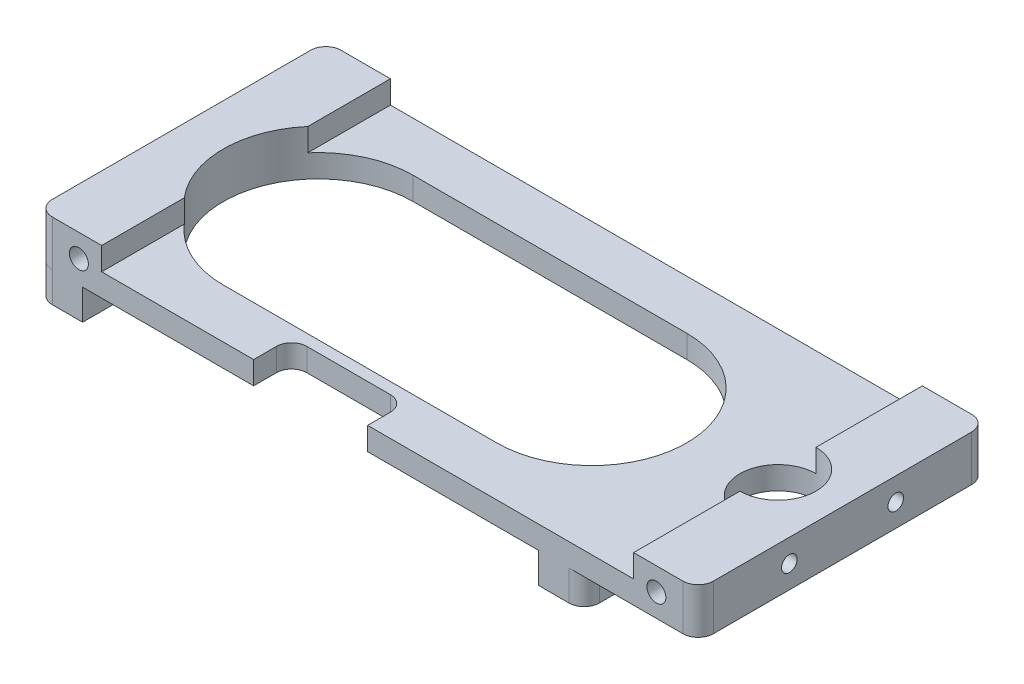
from build123d import *

# Parameters (mm, degrees)
BOSS_EXTRUDE1_DEPTH          = 38
FILLET3_R                    = 2
CUT_EXTRUDE1_DEPTH           = 98.349792201
CUT_EXTRUDE1_DEPTH_BACK      = 98.349792201
SKETCH3_W                    = 15
SKETCH3_H                    = 5
M3X0_5_TAPPED_HOLE3_D        = 2.5
M3X0_5_TAPPED_HOLE3_DEPTH    = 7.5
M3X0_5_TAPPED_HOLE3_TIP      = 0.751075774
M3X0_5_TAPPED_HOLE4_D        = 2.5
M3X0_5_TAPPED_HOLE4_DEPTH    = 7.5
M3X0_5_TAPPED_HOLE4_TIP      = 0.751075774
M2_5X0_45_TAPPED_HOLE1_D     = 2.05
M2_5X0_45_TAPPED_HOLE1_DEPTH = 6.35
M2_5X0_45_TAPPED_HOLE1_TIP   = 0.615882135
M2_5X0_45_TAPPED_HOLE2_D     = 2.05
M2_5X0_45_TAPPED_HOLE2_DEPTH = 6.35
M2_5X0_45_TAPPED_HOLE2_TIP   = 0.615882135
SKETCH14_R                   = 5
CUT_EXTRUDE2_DEPTH           = 98.488368751
SKETCH16_W                   = 6
SKETCH16_H                   = 6
BOSS_EXTRUDE2_DEPTH          = 4
FILLET4_R                    = 2
M3X0_5_TAPPED_HOLE5_D        = 2.5
M3X0_5_TAPPED_HOLE5_DEPTH    = 5.5
M3X0_5_TAPPED_HOLE5_TIP      = 0.751075774


with BuildPart() as part:
    # Sketch2 → Boss-Extrude1 (new body)
    with BuildSketch(Plane.XY.offset(11)):
        Polygon((-84.06534388, 85.95185693), (-75.56534388, 85.95185693), (-75.56534388, 82.95185693), (-5.56534388, 82.95185693), (-5.56534388, 85.95185693), (2.93465612, 85.95185693), (2.93465612, 79.95185693), (-84.06534388, 79.95185693), align=None)
    extrude(amount=BOSS_EXTRUDE1_DEPTH)

    # Fillet3
    fillet3_edges = [part.edges().sort_by_distance(p)[0] for p in [
        (2.93465612, 82.95185693, 49),
        (-84.06534388, 82.95185693, 11),
        (-84.06534388, 82.95185693, 49),
        (2.93465612, 82.95185693, 11),
    ]]
    fillet(fillet3_edges, radius=FILLET3_R)

    # Sketch3 → Cut-Extrude1 (cut, two sides: drawn at the far end of the back side and taken through both)
    with BuildSketch(Plane(origin=(0, 82.95185693, 0), x_dir=(1, 0, 0), z_dir=(0, 1, 0)).offset(-CUT_EXTRUDE1_DEPTH_BACK)):
        with BuildLine():
            Line((-66.06534388, -42.5), (-30.06534388, -42.5))
            ThreePointArc((-30.06534388, -42.5), (-17.56534388, -30), (-30.06534388, -17.5))
            Line((-30.06534388, -17.5), (-66.06534388, -17.5))
            ThreePointArc((-66.06534388, -17.5), (-78.56534388, -30), (-66.06534388, -42.5))
        make_face()
        with Locations((-48.06534388, -46.5)):
            Rectangle(SKETCH3_W, SKETCH3_H)
    extrude(amount=CUT_EXTRUDE1_DEPTH + CUT_EXTRUDE1_DEPTH_BACK, mode=Mode.SUBTRACT)

    # M3x0.5 Tapped Hole3
    with Locations(Plane.XY.offset(49)):
        with Locations((-78.56534388, 82.95185693), (-2.56534388, 82.95185693)):
            Hole(M3X0_5_TAPPED_HOLE3_D / 2, depth=M3X0_5_TAPPED_HOLE3_DEPTH)
            with Locations((0, 0, -(M3X0_5_TAPPED_HOLE3_DEPTH + M3X0_5_TAPPED_HOLE3_TIP / 2))):  # 118° drill point
                Cone(0, M3X0_5_TAPPED_HOLE3_D / 2, M3X0_5_TAPPED_HOLE3_TIP, mode=Mode.SUBTRACT)

    # M3x0.5 Tapped Hole4
    with Locations(Plane(origin=(0, 0, 11), x_dir=(-1, 0, 0), z_dir=(0, 0, -1))):
        with Locations((2.56534388, 82.95185693), (78.56534388, 82.95185693)):
            Hole(M3X0_5_TAPPED_HOLE4_D / 2, depth=M3X0_5_TAPPED_HOLE4_DEPTH)
            with Locations((0, 0, -(M3X0_5_TAPPED_HOLE4_DEPTH + M3X0_5_TAPPED_HOLE4_TIP / 2))):  # 118° drill point
                Cone(0, M3X0_5_TAPPED_HOLE4_D / 2, M3X0_5_TAPPED_HOLE4_TIP, mode=Mode.SUBTRACT)

    # M2.5x0.45 Tapped Hole1
    with Locations(Plane.ZY.offset(84.06534388)):
        with Locations((23, 82.95185693), (37, 82.95185693)):
            Hole(M2_5X0_45_TAPPED_HOLE1_D / 2, depth=M2_5X0_45_TAPPED_HOLE1_DEPTH)
            with Locations((0, 0, -(M2_5X0_45_TAPPED_HOLE1_DEPTH + M2_5X0_45_TAPPED_HOLE1_TIP / 2))):  # 118° drill point
                Cone(0, M2_5X0_45_TAPPED_HOLE1_D / 2, M2_5X0_45_TAPPED_HOLE1_TIP, mode=Mode.SUBTRACT)

    # M2.5x0.45 Tapped Hole2
    with Locations(Plane(origin=(2.93465612, 0, 0), x_dir=(0, 0, -1), z_dir=(1, 0, 0))):
        with Locations((-37, 82.95185693), (-23, 82.95185693)):
            Hole(M2_5X0_45_TAPPED_HOLE2_D / 2, depth=M2_5X0_45_TAPPED_HOLE2_DEPTH)
            with Locations((0, 0, -(M2_5X0_45_TAPPED_HOLE2_DEPTH + M2_5X0_45_TAPPED_HOLE2_TIP / 2))):  # 118° drill point
                Cone(0, M2_5X0_45_TAPPED_HOLE2_D / 2, M2_5X0_45_TAPPED_HOLE2_TIP, mode=Mode.SUBTRACT)

    # Sketch14 → Cut-Extrude2 (cut, through all)
    with BuildSketch(Plane(origin=(0, 85.95185693, 0), x_dir=(1, 0, 0), z_dir=(0, 1, 0))):
        with Locations(Location((-5.56534388, -30, 0), (0, 0, 270))):
            Circle(SKETCH14_R)
    extrude(amount=-CUT_EXTRUDE2_DEPTH, mode=Mode.SUBTRACT)

    # Sketch16 → Boss-Extrude2 (add)
    with BuildSketch(Plane.XZ.offset(-79.95185693)):
        with Locations((-81.06534388, 46)):
            Rectangle(SKETCH16_W, SKETCH16_H)
        with Locations((-81.06534388, 14)):
            Rectangle(SKETCH16_W, SKETCH16_H)
        with Locations((-15.06534388, 46)):
            Rectangle(SKETCH16_W, SKETCH16_H)
        with Locations((-15.06534388, 14)):
            Rectangle(SKETCH16_W, SKETCH16_H)
    extrude(amount=BOSS_EXTRUDE2_DEPTH)

    # Fillet4
    fillet4_edges = [part.edges().sort_by_distance(p)[0] for p in [
        (-12.06534388, 77.95185693, 11),
        (-84.06534388, 77.95185693, 11),
        (-84.06534388, 77.95185693, 49),
        (-78.06534388, 77.95185693, 43),
        (-78.06534388, 77.95185693, 17),
        (-18.06534388, 77.95185693, 17),
        (-18.06534388, 77.95185693, 43),
        (-12.06534388, 77.95185693, 49),
        (-40.56534388, 81.45185693, 44),
        (-55.56534388, 81.45185693, 44),
    ]]
    fillet(fillet4_edges, radius=FILLET4_R)

    # M3x0.5 Tapped Hole5
    with Locations(Plane.XZ.offset(-75.95185693)):
        with Locations((-81.06534388, 46), (-81.06534388, 14), (-15.06534388, 14), (-15.06534388, 46)):
            Hole(M3X0_5_TAPPED_HOLE5_D / 2, depth=M3X0_5_TAPPED_HOLE5_DEPTH)
            with Locations((0, 0, -(M3X0_5_TAPPED_HOLE5_DEPTH + M3X0_5_TAPPED_HOLE5_TIP / 2))):  # 118° drill point
                Cone(0, M3X0_5_TAPPED_HOLE5_D / 2, M3X0_5_TAPPED_HOLE5_TIP, mode=Mode.SUBTRACT)


solid = part.part
